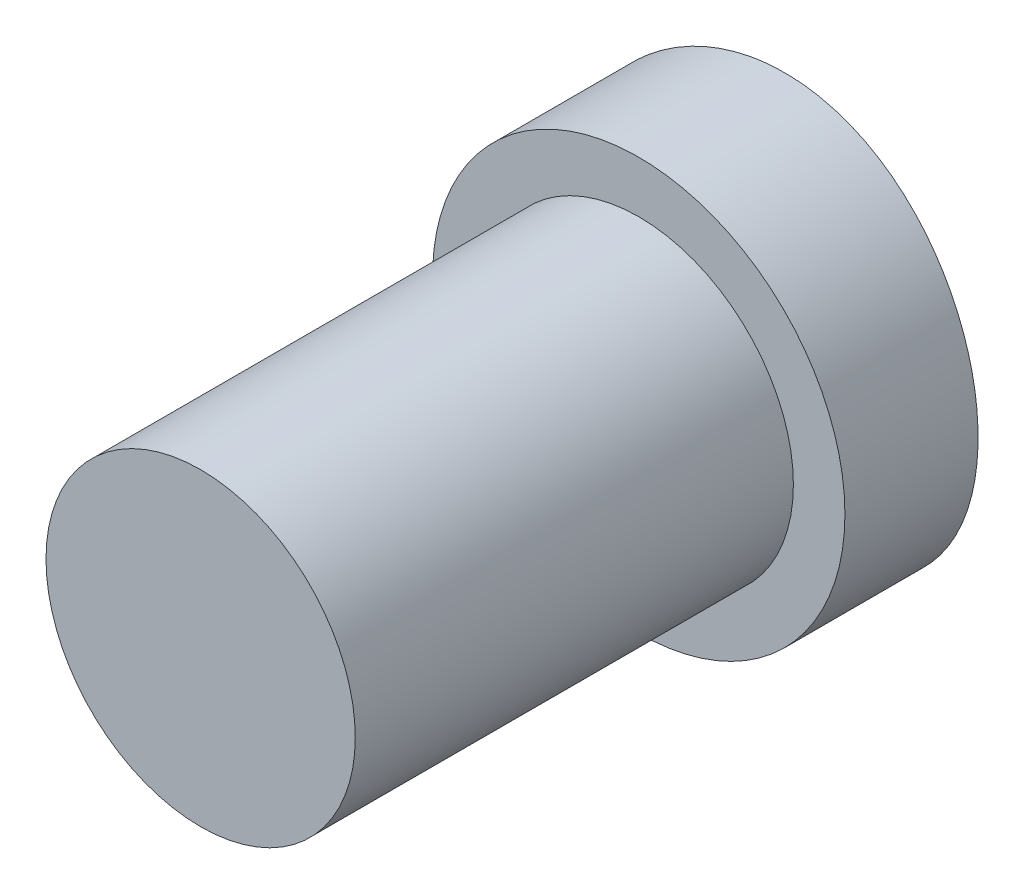
from build123d import *

# Parameters (mm, degrees)
SKETCH1_R           = 4.5
BOSS_EXTRUDE1_DEPTH = 17
SKETCH1_4_R         = 6
SKETCH1_4_R_2       = 4.5
BOSS_EXTRUDE2_DEPTH = 4.25
CUT_EXTRUDE1_DEPTH  = 6


with BuildPart() as part:
    # Sketch1 → Boss-Extrude1 (new body)
    with BuildSketch(Plane.XY):
        Circle(SKETCH1_R)
    extrude(amount=BOSS_EXTRUDE1_DEPTH)

    # Sketch1<4> → Boss-Extrude2 (add)
    with BuildSketch(Plane.XY):
        Circle(SKETCH1_4_R)
        Circle(SKETCH1_4_R_2, mode=Mode.SUBTRACT)
    extrude(amount=BOSS_EXTRUDE2_DEPTH)

    # Sketch2 → Cut-Extrude1 (cut, symmetric)
    with BuildSketch(Plane(origin=(0, 0, 0), x_dir=(1, 0, 0), z_dir=(0, 1, 0))):
        with BuildLine():
            Line((6, 0), (0.529637427, 0))
            ThreePointArc((0.529637427, 0), (3.27018436, -0.108880819), (6, -0.37451045))
            Line((6, -0.37451045), (6, 0))
        make_face()
        with BuildLine():
            Line((-6, 0), (-6, -0.37451045))
            ThreePointArc((-6, -0.37451045), (-3.27018436, -0.108880819), (-0.529637427, 0))
            Line((-0.529637427, 0), (-6, 0))
        make_face()
    extrude(amount=CUT_EXTRUDE1_DEPTH, both=True, mode=Mode.SUBTRACT)


solid = part.part
